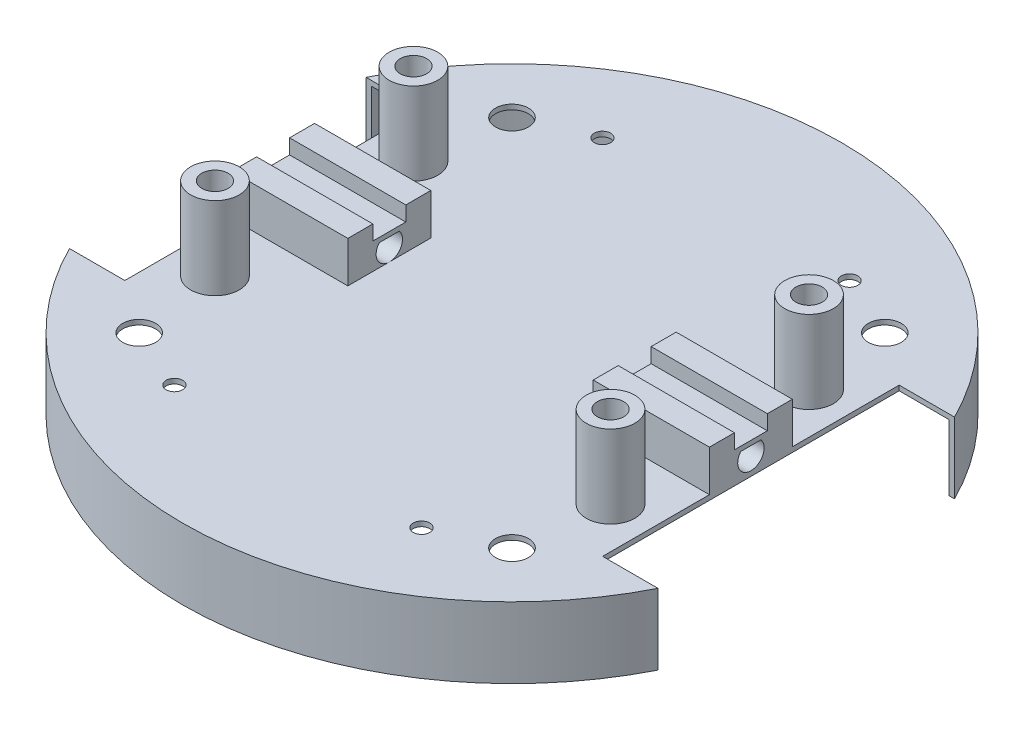
from build123d import *

# Parameters (mm, degrees)
SKETCH_1_R          = 200
EXTRUDE_1_DEPTH     = 3
EXTRUDE_START       = 40
SKETCH_2_R          = 200
SKETCH_2_R_2        = 197
EXTRUDE_2_DEPTH     = 40
SKETCH_3_R          = 10
SKETCH_3_R_2        = 5
CUT_EXTRUDE_2_DEPTH = 287.092642338
SKETCH_4_W          = 70.538651056
SKETCH_4_H          = 15.178755013
EXTRUDE_4_DEPTH     = 25
SKETCH_7_W          = 70.538651056
SKETCH_7_H          = 20
EXTRUDE_5_DEPTH     = 16
CUT_EXTRUDE_5_DEPTH = 383.518831155
SKETCH_10_R         = 14.753670985
SKETCH_10_R_2       = 8
EXTRUDE_8_DEPTH     = 50
CUT_EXTRUDE_START   = -50
SKETCH_12_R         = 8
CUT_EXTRUDE_8_DEPTH = 50


with BuildPart() as part:
    # 草图1 → 凸台-拉伸1 (new body)
    with BuildSketch(Plane(origin=(0, 0, 0), x_dir=(1, 0, 0), z_dir=(0, 1, 0))):
        with Locations(Location((0, 0, 0), (0, 0, 270))):
            Circle(SKETCH_1_R)
    extrude(amount=EXTRUDE_1_DEPTH)

    # 草图2 → 凸台-拉伸2 (add)
    with BuildSketch(Plane.XZ.offset(EXTRUDE_START)):
        with Locations(Location((0, 0, 0), (0, 0, 270))):
            Circle(SKETCH_2_R)
        with Locations(Location((0, 0, 0), (0, 0, 270))):
            Circle(SKETCH_2_R_2, mode=Mode.SUBTRACT)
    extrude(amount=-EXTRUDE_2_DEPTH)

    # 草图3 → 切除-拉伸2 (cut, through all)
    with BuildSketch(Plane(origin=(0, 3, 0), x_dir=(1, 0, 0), z_dir=(0, 1, 0))):
        with BuildLine():
            ThreePointArc((200, 0), (194.577930659, 46.253960917), (178.605710995, 90))
            Line((178.605710995, 90), (145, 90))
            Line((145, 90), (145, -90))
            Line((145, -90), (178.605710995, -90))
            ThreePointArc((178.605710995, -90), (194.577930659, -46.253960917), (200, 0))
        make_face()
        with BuildLine():
            Line((-145, 90), (-178.605710995, 90))
            ThreePointArc((-178.605710995, 90), (-200, 0), (-178.605710995, -90))
            Line((-178.605710995, -90), (-145, -90))
            Line((-145, -90), (-145, 90))
        make_face()
        with Locations(Location((-113.13708499, 113.13708499, 0), (0, 0, 270))):
            Circle(SKETCH_3_R)
        with Locations(Location((-113.13708499, -113.13708499, 0), (0, 0, 270))):
            Circle(SKETCH_3_R)
        with Locations(Location((-75, 129.903810568, 0), (0, 0, 270))):
            Circle(SKETCH_3_R_2)
        with Locations(Location((113.13708499, 113.13708499, 0), (0, 0, 270))):
            Circle(SKETCH_3_R)
        with Locations(Location((75, 129.903810568, 0), (0, 0, 270))):
            Circle(SKETCH_3_R_2)
        with Locations(Location((-75, -129.903810568, 0), (0, 0, 270))):
            Circle(SKETCH_3_R_2)
        with Locations(Location((113.13708499, -113.13708499, 0), (0, 0, 270))):
            Circle(SKETCH_3_R)
        with Locations(Location((75, -129.903810568, 0), (0, 0, 270))):
            Circle(SKETCH_3_R_2)
    extrude(amount=-CUT_EXTRUDE_2_DEPTH, mode=Mode.SUBTRACT)

    # 草图4 → 凸台-拉伸4 (add)
    with BuildSketch(Plane(origin=(0, 3, 0), x_dir=(1, 0, 0), z_dir=(0, 1, 0))):
        with Locations((-109.730674472, 17.589377506)):
            Rectangle(SKETCH_4_W, SKETCH_4_H)
        with Locations((-109.730674472, -17.589377506)):
            Rectangle(SKETCH_4_W, SKETCH_4_H)
        with Locations((109.730674472, 17.589377506)):
            Rectangle(SKETCH_4_W, SKETCH_4_H)
        with Locations((109.730674472, -17.589377506)):
            Rectangle(SKETCH_4_W, SKETCH_4_H)
    extrude(amount=EXTRUDE_4_DEPTH)

    # 草图7 → 凸台-拉伸5 (add)
    with BuildSketch(Plane(origin=(0, 3, 0), x_dir=(1, 0, 0), z_dir=(0, 1, 0))):
        with Locations((-109.730674472, 0)):
            Rectangle(SKETCH_7_W, SKETCH_7_H)
        with Locations((109.730674472, 0)):
            Rectangle(SKETCH_7_W, SKETCH_7_H)
    extrude(amount=EXTRUDE_5_DEPTH)

    # 草图8 → 切除-拉伸5 (cut, through all)
    with BuildSketch(Plane.ZY.offset(145)):
        with BuildLine():
            ThreePointArc((-6.079473661, 16.2), (0, 3), (6.079473661, 16.2))
            Line((6.079473661, 16.2), (-6.079473661, 16.2))
        make_face()
    extrude(amount=-CUT_EXTRUDE_5_DEPTH, mode=Mode.SUBTRACT)

    # 草图10 → 凸台-拉伸8 (add)
    # profile 1 of 4: a face of its own
    with BuildSketch(Plane(origin=(0, 3, 0), x_dir=(1, 0, 0), z_dir=(0, 1, 0))):
        with Locations(Location((-120.048184131, 60.246329015, 0), (0, 0, 270))):
            Circle(SKETCH_10_R)
        with Locations(Location((-120.048184131, 60.246329015, 0), (0, 0, 270))):
            Circle(SKETCH_10_R_2, mode=Mode.SUBTRACT)
    # profile 2 of 4: a face of its own
    with BuildSketch(Plane(origin=(0, 3, 0), x_dir=(1, 0, 0), z_dir=(0, 1, 0))):
        with Locations(Location((-120.048184131, -60.246329015, 0), (0, 0, 270))):
            Circle(SKETCH_10_R)
        with Locations(Location((-120.048184131, -60.246329015, 0), (0, 0, 270))):
            Circle(SKETCH_10_R_2, mode=Mode.SUBTRACT)
    # profile 3 of 4: a face of its own
    with BuildSketch(Plane(origin=(0, 3, 0), x_dir=(1, 0, 0), z_dir=(0, 1, 0))):
        with Locations(Location((120.048184131, -60.246329015, 0), (0, 0, 270))):
            Circle(SKETCH_10_R)
        with Locations(Location((120.048184131, -60.246329015, 0), (0, 0, 270))):
            Circle(SKETCH_10_R_2, mode=Mode.SUBTRACT)
    # profile 4 of 4: a face of its own
    with BuildSketch(Plane(origin=(0, 3, 0), x_dir=(1, 0, 0), z_dir=(0, 1, 0))):
        with Locations(Location((120.048184131, 60.246329015, 0), (0, 0, 270))):
            Circle(SKETCH_10_R)
        with Locations(Location((120.048184131, 60.246329015, 0), (0, 0, 270))):
            Circle(SKETCH_10_R_2, mode=Mode.SUBTRACT)
    extrude(amount=EXTRUDE_8_DEPTH)

    # 草图12 → 切除-拉伸8 (cut)
    with BuildSketch(Plane(origin=(0, 3, 0), x_dir=(1, 0, 0), z_dir=(0, 1, 0)).offset(CUT_EXTRUDE_START)):
        with Locations(Location((-120.048184131, 60.246329015, 0), (0, 0, 270))):
            Circle(SKETCH_12_R)
        with Locations(Location((-120.048184131, -60.246329015, 0), (0, 0, 270))):
            Circle(SKETCH_12_R)
        with Locations(Location((120.048184131, -60.246329015, 0), (0, 0, 270))):
            Circle(SKETCH_12_R)
        with Locations(Location((120.048184131, 60.246329015, 0), (0, 0, 270))):
            Circle(SKETCH_12_R)
    extrude(amount=CUT_EXTRUDE_8_DEPTH, mode=Mode.SUBTRACT)


solid = part.part
